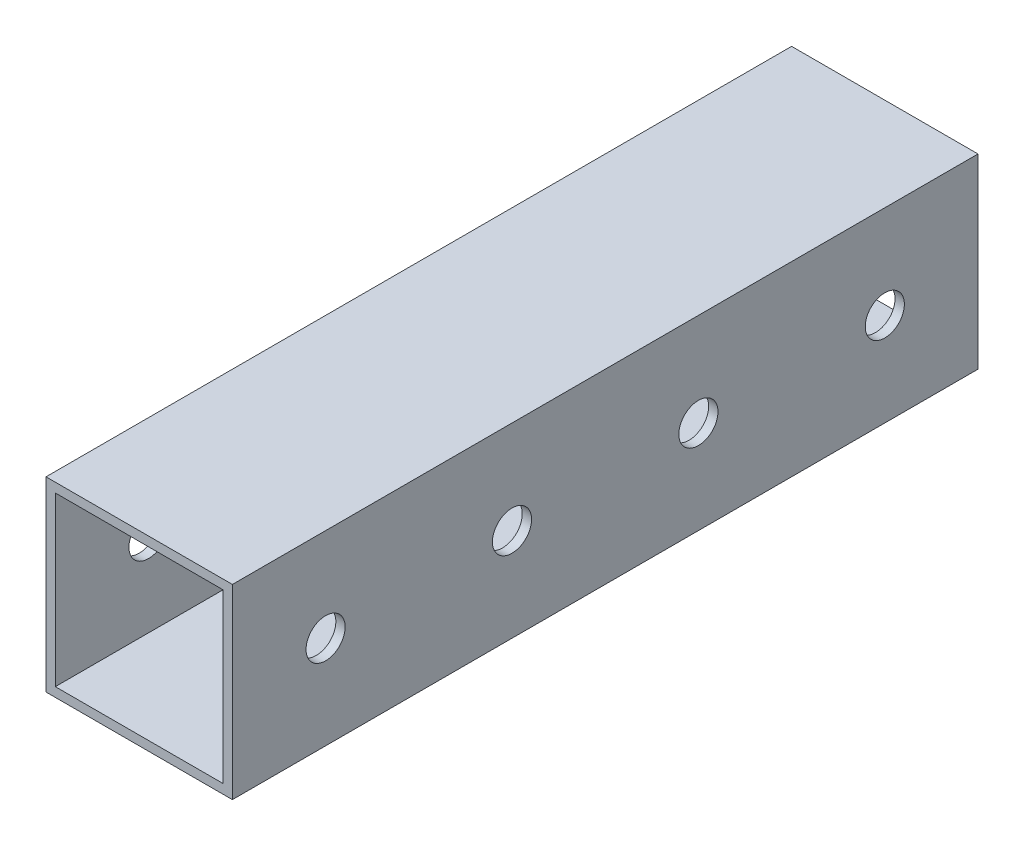
from build123d import *

# Parameters (mm, degrees)
SKETCH_1_W          = 20
SKETCH_1_H          = 20
EXTRUDE_1_DEPTH     = 80
SKETCH_2_R          = 2.1
CUT_EXTRUDE_1_DEPTH = 84.066238629
SKETCH_3_W          = 18
SKETCH_3_H          = 18
CUT_EXTRUDE_2_DEPTH = 82.240384046


with BuildPart() as part:
    # 草图1 → 凸台-拉伸1 (new body)
    with BuildSketch(Plane.XY):
        Rectangle(SKETCH_1_W, SKETCH_1_H)
    extrude(amount=EXTRUDE_1_DEPTH)

    # 草图2 → 切除-拉伸1 (cut, through all)
    with BuildSketch(Plane(origin=(10, 0, 0), x_dir=(0, 0, -1), z_dir=(1, 0, 0))):
        with Locations((-70, 0)):
            Circle(SKETCH_2_R)
        with Locations((-10, 0)):
            Circle(SKETCH_2_R)
        with Locations((-50, 0)):
            Circle(SKETCH_2_R)
        with Locations(Location((-30, 0, 0), (0, 0, 180))):
            Circle(SKETCH_2_R)
    extrude(amount=-CUT_EXTRUDE_1_DEPTH, mode=Mode.SUBTRACT)

    # 草图3 → 切除-拉伸2 (cut, through all)
    with BuildSketch(Plane(origin=(0, 0, 0), x_dir=(-1, 0, 0), z_dir=(0, 0, -1))):
        Rectangle(SKETCH_3_W, SKETCH_3_H)
    extrude(amount=-CUT_EXTRUDE_2_DEPTH, mode=Mode.SUBTRACT)


solid = part.part
